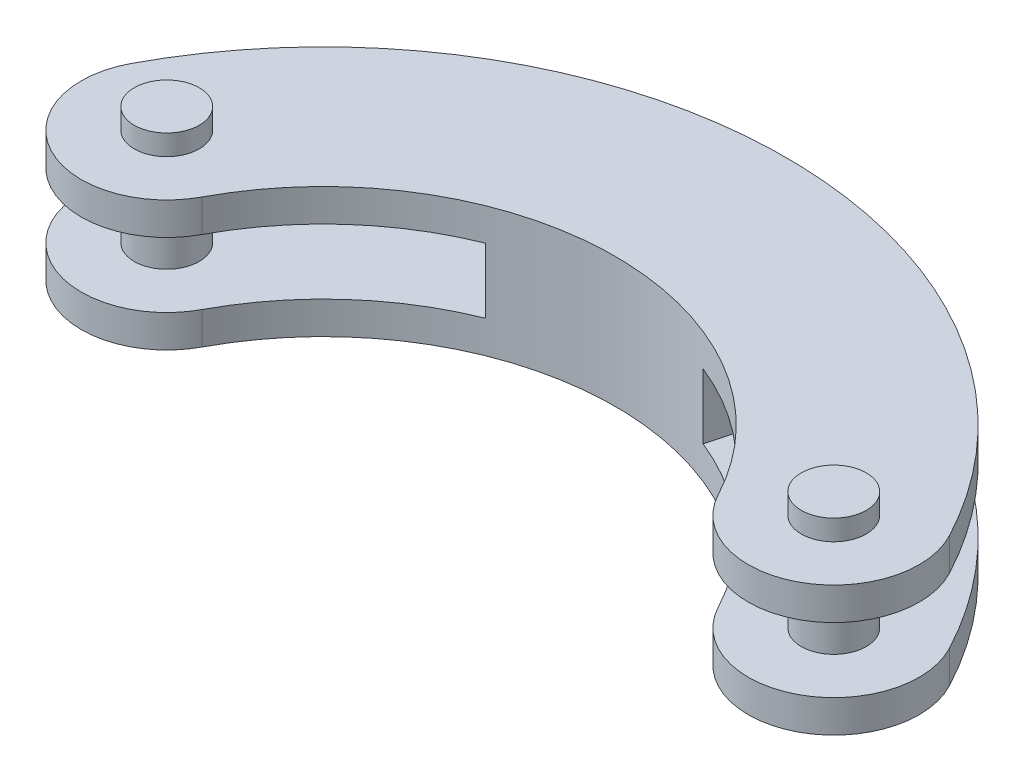
from build123d import *

# Parameters (mm, degrees)
BOSS_EXTRUDE1_DEPTH = 9.5
BOSS_EXTRUDE2_DEPTH = 19
BOSS_EXTRUDE3_DEPTH = 9.5
SKETCH5_R           = 9.5
CUT_EXTRUDE1_DEPTH  = 154.110072724
BOSS_EXTRUDE4_START = 6
SKETCH5_2_R         = 9.5
BOSS_EXTRUDE4_DEPTH = 50


with BuildPart() as part:
    # Sketch2 → Boss-Extrude1 (new body)
    with BuildSketch(Plane(origin=(0, 0, 0), x_dir=(1, 0, 0), z_dir=(0, 1, 0))):
        with BuildLine():
            ThreePointArc((119.580217293, -46.896332496), (0, 25), (-119.580217293, -46.896332496))
            ThreePointArc((-119.580217293, -46.896332496), (-109.224504437, -80.701054226), (-75.419782707, -70.34534137))
            ThreePointArc((-75.419782707, -70.34534137), (0, -25), (75.419782707, -70.34534137))
            ThreePointArc((75.419782707, -70.34534137), (109.224504437, -80.701054226), (119.580217293, -46.896332496))
        make_face()
    extrude(amount=BOSS_EXTRUDE1_DEPTH)

    # Sketch3 → Boss-Extrude2 (add)
    with BuildSketch(Plane(origin=(0, 9.5, 0), x_dir=(1, 0, 0), z_dir=(0, 1, 0))):
        with BuildLine():
            Line((-44.843451744, 17.358040295), (-31.843255272, -31.159353446))
            ThreePointArc((-31.843255272, -31.159353446), (0, -25), (31.843255272, -31.159353446))
            Line((31.843255272, -31.159353446), (44.843451744, 17.358040295))
            ThreePointArc((44.843451744, 17.358040295), (0, 25), (-44.843451744, 17.358040295))
        make_face()
    extrude(amount=BOSS_EXTRUDE2_DEPTH)

    # Sketch4 → Boss-Extrude3 (add)
    with BuildSketch(Plane(origin=(0, 28.5, 0), x_dir=(1, 0, 0), z_dir=(0, 1, 0))):
        with BuildLine():
            ThreePointArc((119.580217293, -46.896332496), (0, 25), (-119.580217293, -46.896332496))
            ThreePointArc((-119.580217293, -46.896332496), (-109.224504437, -80.701054226), (-75.419782707, -70.34534137))
            ThreePointArc((-75.419782707, -70.34534137), (0, -25), (75.419782707, -70.34534137))
            ThreePointArc((75.419782707, -70.34534137), (109.224504437, -80.701054226), (119.580217293, -46.896332496))
        make_face()
    extrude(amount=BOSS_EXTRUDE3_DEPTH)

    # Sketch5 → Cut-Extrude1 (cut, through all)
    with BuildSketch(Plane(origin=(0, 38, 0), x_dir=(1, 0, 0), z_dir=(0, 1, 0))):
        with Locations((-97.5, -58.620836933)):
            Circle(SKETCH5_R)
        with Locations((97.5, -58.620836933)):
            Circle(SKETCH5_R)
    extrude(amount=-CUT_EXTRUDE1_DEPTH, mode=Mode.SUBTRACT)

    # Sketch5<2> → Boss-Extrude4 (add)
    with BuildSketch(Plane(origin=(0, 38, 0), x_dir=(1, 0, 0), z_dir=(0, 1, 0)).offset(BOSS_EXTRUDE4_START)):
        with Locations((-97.5, -58.620836933)):
            Circle(SKETCH5_2_R)
        with Locations((97.5, -58.620836933)):
            Circle(SKETCH5_2_R)
    extrude(amount=-BOSS_EXTRUDE4_DEPTH)


solid = part.part
